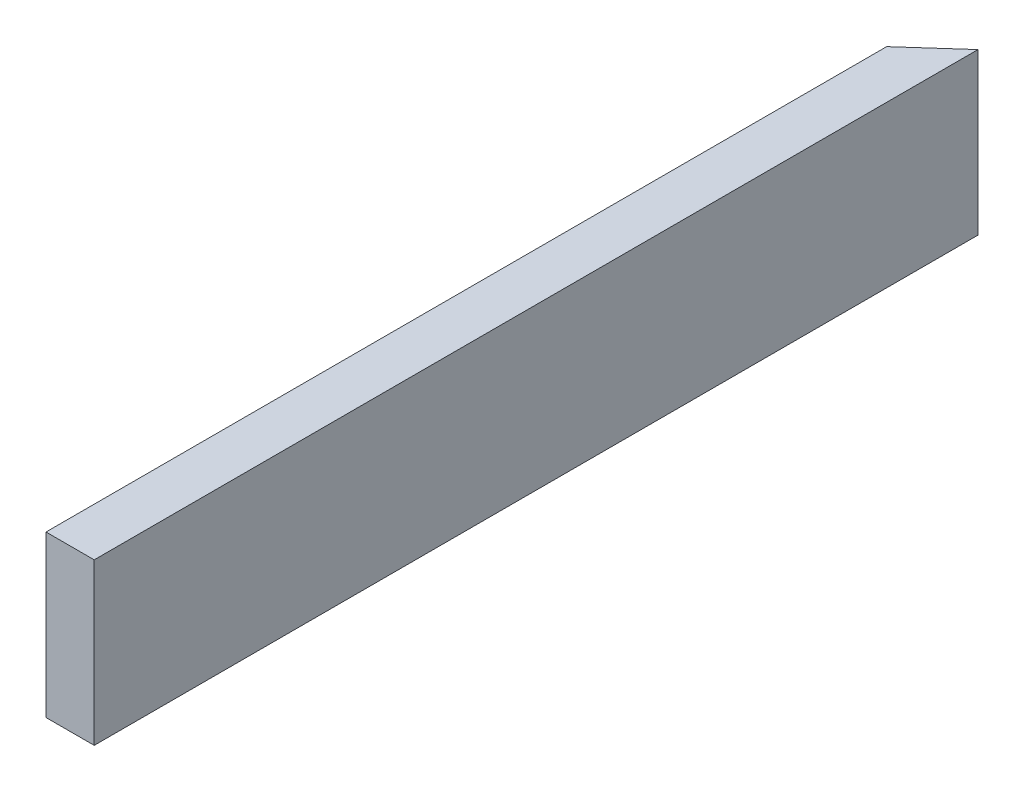
from build123d import *

# Parameters (mm, degrees)
SKETCH1_W           = 3
SKETCH1_H           = 10
BOSS_EXTRUDE1_DEPTH = 55
CUT_EXTRUDE1_DEPTH  = 52


with BuildPart() as part:
    # Sketch1 → Boss-Extrude1 (new body)
    with BuildSketch(Plane.XY):
        with Locations((-2.403225806, 7.838709677)):
            Rectangle(SKETCH1_W, SKETCH1_H)
    extrude(amount=BOSS_EXTRUDE1_DEPTH)

    # Sketch3 → Cut-Extrude1 (cut)
    with BuildSketch(Plane(origin=(0, 12.838709677, 0), x_dir=(1, 0, 0), z_dir=(0, 1, 0))):
        Polygon((-0.903225806, 0), (-3.903225806, -2.682309573), (-3.903225806, 0), align=None)
    extrude(amount=-CUT_EXTRUDE1_DEPTH, mode=Mode.SUBTRACT)


solid = part.part
